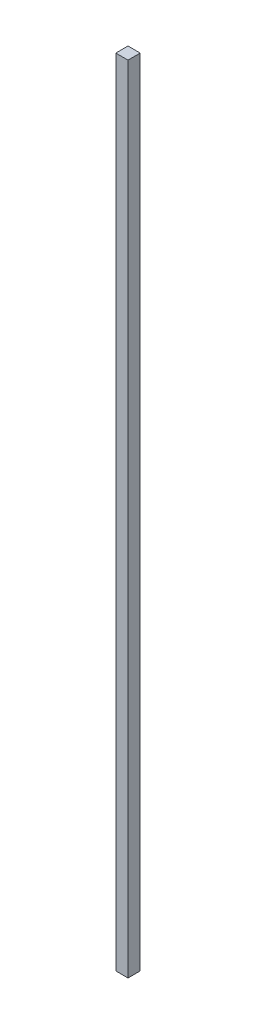
from build123d import *

# Parameters (mm, degrees)
SKETCH1_W           = 20
SKETCH1_H           = 20
SKETCH1_W_2         = 16
SKETCH1_H_2         = 16
BOSS_EXTRUDE1_DEPTH = 1300
SKETCH2_W           = 20
SKETCH2_H           = 20
BOSS_EXTRUDE2_DEPTH = 1
SKETCH3_W           = 20
SKETCH3_H           = 20
BOSS_EXTRUDE3_DEPTH = 1


with BuildPart() as part:
    # Sketch1 → Boss-Extrude1 (new body)
    with BuildSketch(Plane(origin=(0, 0, 0), x_dir=(1, 0, 0), z_dir=(0, 1, 0))):
        Rectangle(SKETCH1_W, SKETCH1_H)
        Rectangle(SKETCH1_W_2, SKETCH1_H_2, mode=Mode.SUBTRACT)
    extrude(amount=BOSS_EXTRUDE1_DEPTH)

    # Sketch2 → Boss-Extrude2 (add)
    with BuildSketch(Plane(origin=(0, 1300, 0), x_dir=(1, 0, 0), z_dir=(0, 1, 0))):
        Rectangle(SKETCH2_W, SKETCH2_H)
    extrude(amount=BOSS_EXTRUDE2_DEPTH)

    # Sketch3 → Boss-Extrude3 (add)
    with BuildSketch(Plane.XZ):
        Rectangle(SKETCH3_W, SKETCH3_H)
    extrude(amount=BOSS_EXTRUDE3_DEPTH)


solid = part.part
